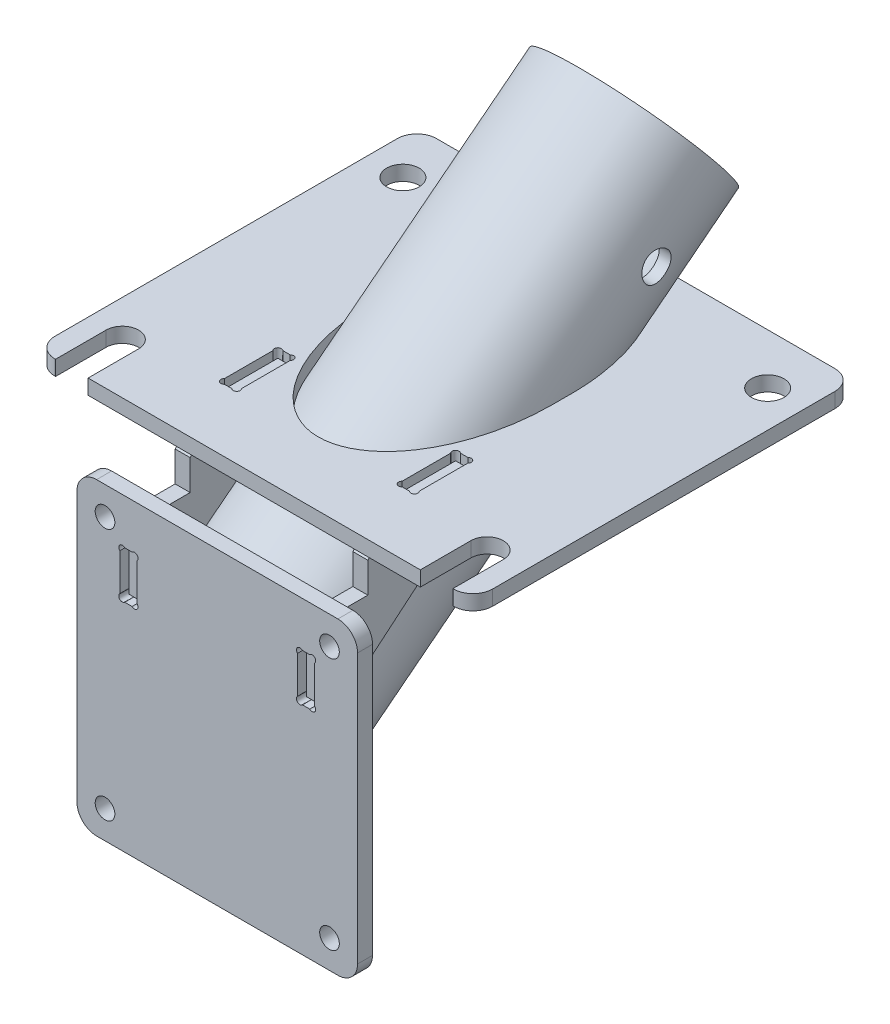
from build123d import *

# Parameters (mm, degrees)
SKETCH6_W                      = 2.667
SKETCH6_H                      = 55
BOSS_EXTRUDE2_DEPTH            = 25
SKETCH7_W                      = 68
SKETCH7_H                      = 2.667
BOSS_EXTRUDE3_DEPTH            = 39
BOSS_EXTRUDE4_START            = 14.5
BOSS_EXTRUDE4_DEPTH            = 2.667
SKETCH9_W                      = 1.75
SKETCH9_H                      = 84.074629129
M5X0_8_TAPPED_HOLE1_AT_2_COUNT = 2
M5X0_8_TAPPED_HOLE1_AT_2_PITCH = 45
M5X0_8_TAPPED_HOLE1_AT_3_COUNT = 2
M5X0_8_TAPPED_HOLE1_AT_3_PITCH = 60.207972894
M5X0_8_TAPPED_HOLE1_AT_4_COUNT = 2
M5X0_8_TAPPED_HOLE1_AT_4_PITCH = 40
SKETCH11_W                     = 2.9
SKETCH11_H                     = 63.3335
M5_CLEARANCE_HOLE1_AT_2_COUNT  = 2
M5_CLEARANCE_HOLE1_AT_2_PITCH  = 50
M5_CLEARANCE_HOLE1_AT_3_COUNT  = 2
M5_CLEARANCE_HOLE1_AT_3_PITCH  = 82.006097334
M5_CLEARANCE_HOLE1_AT_4_COUNT  = 2
M5_CLEARANCE_HOLE1_AT_4_PITCH  = 65
FILLET1_R                      = 3.5
CUT_EXTRUDE2_DEPTH             = 112.257479172
FILLET2_R                      = 3.5
CUT_EXTRUDE4_DEPTH             = 148.519036975
CUT_EXTRUDE6_DEPTH             = 6.35
SKETCH21_W                     = 1.25
SKETCH21_H                     = 8
SKETCH21_W_2                   = 10
SKETCH21_H_2                   = 1.25
BOSS_EXTRUDE5_DEPTH            = 2.667
SKETCH22_W                     = 3.067
SKETCH22_H                     = 10.4
CUT_EXTRUDE7_DEPTH             = 112.257479207
SKETCH23_W                     = 3.067
SKETCH23_H                     = 8.4
CUT_EXTRUDE8_DEPTH             = 140.317317988
CUT_EXTRUDE9_DEPTH             = 145.293444655
SKETCH25_R                     = 2.6
CUT_EXTRUDE10_DEPTH            = 155.109916247
SKETCH26_R                     = 0.625
CUT_EXTRUDE11_DEPTH            = 112.257479282
SKETCH27_R                     = 0.625
CUT_EXTRUDE12_DEPTH            = 140.317318123
CUT_EXTRUDE14_DEPTH            = 139.516664395
CUT_EXTRUDE14_DEPTH_BACK       = 139.516664395


with BuildPart() as part:
    # Sketch5 → Revolve2 (revolve)
    with BuildSketch(Plane(origin=(0, 0, 0), x_dir=(0, 0, -1), z_dir=(1, 0, 0)), mode=Mode.PRIVATE) as revolve2_sk:
        Polygon((0, 54.645664164), (0, 51.970319963), (21.796996462, 69), (18.372712039, 69), align=None)
        Polygon((18.372712039, 69), (21.796996462, 69), (64.491814809, 102.356847901), (63.193877287, 104.018132172), align=None)
        Polygon((-19.825335827, 36.481070041), (0, 51.970319963), (0, 54.645664164), (-21.123273349, 38.142354312), align=None)
    revolve(revolve2_sk.sketch.rotate(Axis((0, 34.5, 0), (0, 0.6156614753256595, -0.7880107536067211)), 180), axis=Axis((0, 34.5, 0), (0, 0.6156614753256595, -0.7880107536067211)))

    # Sketch17 → Cut-Extrude4 (cut, through all)
    with BuildSketch(Plane.ZY.offset(25)):
        Polygon((21.123273349, 38.142354312), (1.3335, 53.603819781), (1.3335, 12.812599511), align=None)
    extrude(amount=-CUT_EXTRUDE4_DEPTH, mode=Mode.SUBTRACT)

    # Sketch25 → Cut-Extrude10 (cut, through all)
    with BuildSketch(Plane(origin=(39, 0, 0), x_dir=(0, 0, -1), z_dir=(1, 0, 0))):
        with Locations((61.147341904, 82.273539329)):
            Circle(SKETCH25_R)
    extrude(amount=-CUT_EXTRUDE10_DEPTH, mode=Mode.SUBTRACT)

    # Sketch28 → Cut-Extrude14 (cut, two sides: drawn at the far end of the back side and taken through both)
    with BuildSketch(Plane(origin=(0, 0, 0), x_dir=(0, 0, -1), z_dir=(1, 0, 0)).offset(-CUT_EXTRUDE14_DEPTH_BACK)):
        Polygon((-1.375280655, 53.571177156), (1.3335, 55.687508547), (1.3335, 15.396180219), (-1.3335, 13.312491453), align=None)
    extrude(amount=CUT_EXTRUDE14_DEPTH + CUT_EXTRUDE14_DEPTH_BACK, mode=Mode.SUBTRACT)


with BuildPart() as body_2:
    # Sketch6 → Boss-Extrude2 (new, symmetric)
    with BuildSketch(Plane(origin=(0, 0, 0), x_dir=(0, 0, -1), z_dir=(1, 0, 0))):
        with Locations((0, 34.5)):
            Rectangle(SKETCH6_W, SKETCH6_H)
    extrude(amount=BOSS_EXTRUDE2_DEPTH, both=True)

    # Sketch9 → M5x0.8 Tapped Hole1 (revolve, cut)
    with BuildSketch(Plane(origin=(-20, 57, 1.3335), x_dir=(0, -1, 0), z_dir=(1, 0, 0))):
        with Locations((0.875, 42.037314565)):
            Rectangle(SKETCH9_W, SKETCH9_H)
    m5x0_8_tapped_hole1 = revolve(axis=Axis((-20, 57, 7.6835), (0, 0, -1)), mode=Mode.SUBTRACT)

    # M5x0.8 Tapped Hole1 at 2: M5x0.8 Tapped Hole1 ×2
    with Locations(*[(0, -i * M5X0_8_TAPPED_HOLE1_AT_2_PITCH, 0) for i in range(1, M5X0_8_TAPPED_HOLE1_AT_2_COUNT)]):
        add(m5x0_8_tapped_hole1, mode=Mode.SUBTRACT)

    # M5x0.8 Tapped Hole1 at 3: M5x0.8 Tapped Hole1 ×2
    with Locations(*[Vector(0.66436383882992, -0.7474093186836596, 0) * (i * M5X0_8_TAPPED_HOLE1_AT_3_PITCH) for i in range(1, M5X0_8_TAPPED_HOLE1_AT_3_COUNT)]):
        add(m5x0_8_tapped_hole1, mode=Mode.SUBTRACT)

    # M5x0.8 Tapped Hole1 at 4: M5x0.8 Tapped Hole1 ×2
    with Locations(*[(i * M5X0_8_TAPPED_HOLE1_AT_4_PITCH, 0, 0) for i in range(1, M5X0_8_TAPPED_HOLE1_AT_4_COUNT)]):
        add(m5x0_8_tapped_hole1, mode=Mode.SUBTRACT)

    # Fillet2
    fillet2_edges = [body_2.edges().sort_by_distance(p)[0] for p in [
        (25, 62, 0),
        (-25, 62, 0),
        (-25, 7, 0),
        (25, 7, 0),
    ]]
    fillet(fillet2_edges, radius=FILLET2_R)

    # Sketch23 → Cut-Extrude8 (cut, through all)
    with BuildSketch(Plane.XY.offset(1.3335)):
        with Locations((15.8335, 49.779949141)):
            Rectangle(SKETCH23_W, SKETCH23_H)
        with Locations((-15.8335, 49.779949141)):
            Rectangle(SKETCH23_W, SKETCH23_H)
    extrude(amount=-CUT_EXTRUDE8_DEPTH, mode=Mode.SUBTRACT)

    # Sketch27 → Cut-Extrude12 (cut, through all)
    with BuildSketch(Plane.XY.offset(1.3335)):
        with Locations((14.741941738, 53.538007403)):
            Circle(SKETCH27_R)
        with Locations((16.925058262, 53.538007403)):
            Circle(SKETCH27_R)
        with Locations((16.925058262, 46.021890879)):
            Circle(SKETCH27_R)
        with Locations((14.741941738, 46.021890879)):
            Circle(SKETCH27_R)
        with Locations((-16.925058262, 53.538007403)):
            Circle(SKETCH27_R)
        with Locations((-14.741941738, 53.538007403)):
            Circle(SKETCH27_R)
        with Locations((-16.925058262, 46.021890879)):
            Circle(SKETCH27_R)
        with Locations((-14.741941738, 46.021890879)):
            Circle(SKETCH27_R)
    extrude(amount=-CUT_EXTRUDE12_DEPTH, mode=Mode.SUBTRACT)


with BuildPart() as body_3:
    # Sketch7 → Boss-Extrude3 (new, symmetric)
    with BuildSketch(Plane(origin=(0, 0, 0), x_dir=(0, 0, -1), z_dir=(1, 0, 0))):
        with Locations((39.25, 69)):
            Rectangle(SKETCH7_W, SKETCH7_H)
    extrude(amount=BOSS_EXTRUDE3_DEPTH, both=True)

    # Sketch11 → M5 Clearance Hole1 (revolve, cut)
    with BuildSketch(Plane(origin=(-32.5, 70.3335, -64.25), x_dir=(0, 0, 1), z_dir=(1, 0, 0))):
        with Locations((1.45, 31.66675)):
            Rectangle(SKETCH11_W, SKETCH11_H)
    m5_clearance_hole1 = revolve(axis=Axis((-32.5, 76.6835, -64.25), (0, -1, 0)), mode=Mode.SUBTRACT)

    # M5 Clearance Hole1 at 2: M5 Clearance Hole1 ×2
    with Locations(*[(0, 0, i * M5_CLEARANCE_HOLE1_AT_2_PITCH) for i in range(1, M5_CLEARANCE_HOLE1_AT_2_COUNT)]):
        add(m5_clearance_hole1, mode=Mode.SUBTRACT)

    # M5 Clearance Hole1 at 3: M5 Clearance Hole1 ×2
    with Locations(*[Vector(0.7926239891046001, 0, 0.6097107608496924) * (i * M5_CLEARANCE_HOLE1_AT_3_PITCH) for i in range(1, M5_CLEARANCE_HOLE1_AT_3_COUNT)]):
        add(m5_clearance_hole1, mode=Mode.SUBTRACT)

    # M5 Clearance Hole1 at 4: M5 Clearance Hole1 ×2
    with Locations(*[(i * M5_CLEARANCE_HOLE1_AT_4_PITCH, 0, 0) for i in range(1, M5_CLEARANCE_HOLE1_AT_4_COUNT)]):
        add(m5_clearance_hole1, mode=Mode.SUBTRACT)

    # Fillet1
    fillet1_edges = [body_3.edges().sort_by_distance(p)[0] for p in [
        (39, 69, -5.25),
        (39, 69, -73.25),
        (-39, 69, -5.25),
        (-39, 69, -73.25),
    ]]
    fillet(fillet1_edges, radius=FILLET1_R)

    # Sketch14 → Cut-Extrude2 (cut, through all)
    with BuildSketch(Plane(origin=(0, 70.3335, 0), x_dir=(1, 0, 0), z_dir=(0, 1, 0))):
        with BuildLine():
            Line((-35.4, -3.75), (-35.4, 14.25))
            ThreePointArc((-35.4, 14.25), (-32.5, 17.15), (-29.6, 14.25))
            Line((-29.6, 14.25), (-29.6, -3.75))
            ThreePointArc((-29.6, -3.75), (-32.5, -6.65), (-35.4, -3.75))
        make_face()
        with BuildLine():
            Line((35.4, -3.75), (35.4, 14.25))
            ThreePointArc((35.4, 14.25), (32.5, 17.15), (29.6, 14.25))
            Line((29.6, 14.25), (29.6, -3.75))
            ThreePointArc((29.6, -3.75), (32.5, -6.65), (35.4, -3.75))
        make_face()
    extrude(amount=-CUT_EXTRUDE2_DEPTH, mode=Mode.SUBTRACT)

    # Sketch20 → Cut-Extrude6 (cut)
    # profile 1 of 2: a face of its own
    with BuildSketch(Plane(origin=(0, 70.3335, 0), x_dir=(1, 0, 0), z_dir=(0, 1, 0))):
        with BuildLine():
            Line((15.875, 42.451184144), (15.875, 45.864788477))
            add(Edge.make_bspline(
                [(15.875, 45.864788477), (15.875, 71.650062749), (0, 71.650062749), (-15.875, 71.650062749), (-15.875, 45.864788477)],
                knots=[4.71238898, 4.71238898, 4.71238898, 6.283185307, 6.283185307, 7.853981634, 7.853981634, 7.853981634], degree=2, weights=[1, 0.707106781, 1, 0.707106781, 1]))
            Line((-15.875, 45.864788477), (-15.875, 42.451184144))
            add(Edge.make_bspline(
                [(-15.875, 42.451184144), (-15.875, 16.665909872), (0, 16.665909872), (15.875, 16.665909872), (15.875, 42.451184144)],
                knots=[1.570796327, 1.570796327, 1.570796327, 3.141592654, 3.141592654, 4.71238898, 4.71238898, 4.71238898], degree=2, weights=[1, 0.707106781, 1, 0.707106781, 1]))
        make_face()
        with BuildLine():
            add(Edge.make_bspline(
                [(15.840183661, 44.157986311), (14.856770864, 68.236458416), (0, 68.236458416), (-14.856770864, 68.236458416), (-15.840183661, 44.157986311)],
                knots=[4.778630317, 4.778630317, 4.778630317, 6.283185307, 6.283185307, 7.787740298, 7.787740298, 7.787740298], degree=2, weights=[1, 0.730134544, 1, 0.730134544, 1]))
            add(Edge.make_bspline(
                [(-15.840183661, 44.157986311), (-14.856770864, 20.079514205), (0, 20.079514205), (14.856770864, 20.079514205), (15.840183661, 44.157986311)],
                knots=[1.637037663, 1.637037663, 1.637037663, 3.141592654, 3.141592654, 4.646147644, 4.646147644, 4.646147644], degree=2, weights=[1, 0.730134544, 1, 0.730134544, 1]))
        make_face(mode=Mode.SUBTRACT)
    # profile 2 of 2: a face of its own
    with BuildSketch(Plane(origin=(0, 70.3335, 0), x_dir=(1, 0, 0), z_dir=(0, 1, 0))):
        with BuildLine():
            add(Edge.make_bspline(
                [(-15.840183661, 44.157986311), (-14.856770864, 20.079514205), (0, 20.079514205), (14.856770864, 20.079514205), (15.840183661, 44.157986311)],
                knots=[1.637037663, 1.637037663, 1.637037663, 3.141592654, 3.141592654, 4.646147644, 4.646147644, 4.646147644], degree=2, weights=[1, 0.730134544, 1, 0.730134544, 1]))
            add(Edge.make_bspline(
                [(15.840183661, 44.157986311), (14.856770864, 68.236458416), (0, 68.236458416), (-14.856770864, 68.236458416), (-15.840183661, 44.157986311)],
                knots=[4.778630317, 4.778630317, 4.778630317, 6.283185307, 6.283185307, 7.787740298, 7.787740298, 7.787740298], degree=2, weights=[1, 0.730134544, 1, 0.730134544, 1]))
        make_face()
    extrude(amount=-CUT_EXTRUDE6_DEPTH, mode=Mode.SUBTRACT)

    # Sketch22 → Cut-Extrude7 (cut, through all)
    with BuildSketch(Plane(origin=(0, 70.3335, 0), x_dir=(1, 0, 0), z_dir=(0, 1, 0))):
        with Locations((15.8335, 21.632934253)):
            Rectangle(SKETCH22_W, SKETCH22_H)
        with Locations((-15.8335, 21.632934253)):
            Rectangle(SKETCH22_W, SKETCH22_H)
    extrude(amount=-CUT_EXTRUDE7_DEPTH, mode=Mode.SUBTRACT)

    # Sketch26 → Cut-Extrude11 (cut, through all)
    with BuildSketch(Plane(origin=(0, 70.3335, 0), x_dir=(1, 0, 0), z_dir=(0, 1, 0))):
        with Locations((14.741941738, 26.390992515)):
            Circle(SKETCH26_R)
        with Locations((16.925058262, 26.390992515)):
            Circle(SKETCH26_R)
        with Locations((16.925058262, 16.874875991)):
            Circle(SKETCH26_R)
        with Locations((14.741941738, 16.874875991)):
            Circle(SKETCH26_R)
        with Locations((-16.925058262, 26.390992515)):
            Circle(SKETCH26_R)
        with Locations((-14.741941738, 26.390992515)):
            Circle(SKETCH26_R)
        with Locations((-16.925058262, 16.874875991)):
            Circle(SKETCH26_R)
        with Locations((-14.741941738, 16.874875991)):
            Circle(SKETCH26_R)
    extrude(amount=-CUT_EXTRUDE11_DEPTH, mode=Mode.SUBTRACT)


with BuildPart() as body_4:
    # Sketch8 → Boss-Extrude4 (new body)
    with BuildSketch(Plane(origin=(0, 0, 0), x_dir=(0, 0, -1), z_dir=(1, 0, 0)).offset(BOSS_EXTRUDE4_START)):
        Polygon((1.3335, 57.059898282), (11.940101718, 67.6665), (31.325766788, 67.6665), (1.3335, 42.5), align=None)
    extrude(amount=BOSS_EXTRUDE4_DEPTH)

    # Sketch21 → Boss-Extrude5 (add)
    with BuildSketch(Plane(origin=(17.167, 0, 0), x_dir=(0, 0, -1), z_dir=(1, 0, 0))):
        with Locations((0.7085, 49.779949141)):
            Rectangle(SKETCH21_W, SKETCH21_H)
        with Locations((21.632934253, 68.2915)):
            Rectangle(SKETCH21_W_2, SKETCH21_H_2)
    extrude(amount=-BOSS_EXTRUDE5_DEPTH)

    # Sketch24 → Cut-Extrude9 (cut, through all)
    with BuildSketch(Plane(origin=(17.167, 0, 0), x_dir=(0, 0, -1), z_dir=(1, 0, 0))):
        Polygon((8.3335, 64.059898282), (8.3335, 58.6665), (2.940101718, 58.6665), align=None)
    extrude(amount=-CUT_EXTRUDE9_DEPTH, mode=Mode.SUBTRACT)


with BuildPart() as body_5:
    # Mirror1: mirrored copy
    add(body_4.part.mirror(Plane(origin=(0, 0, 0), x_dir=(0, 0, 1), z_dir=(1, 0, 0))))


solid = Compound([part.part, body_2.part, body_3.part, body_4.part, body_5.part])
